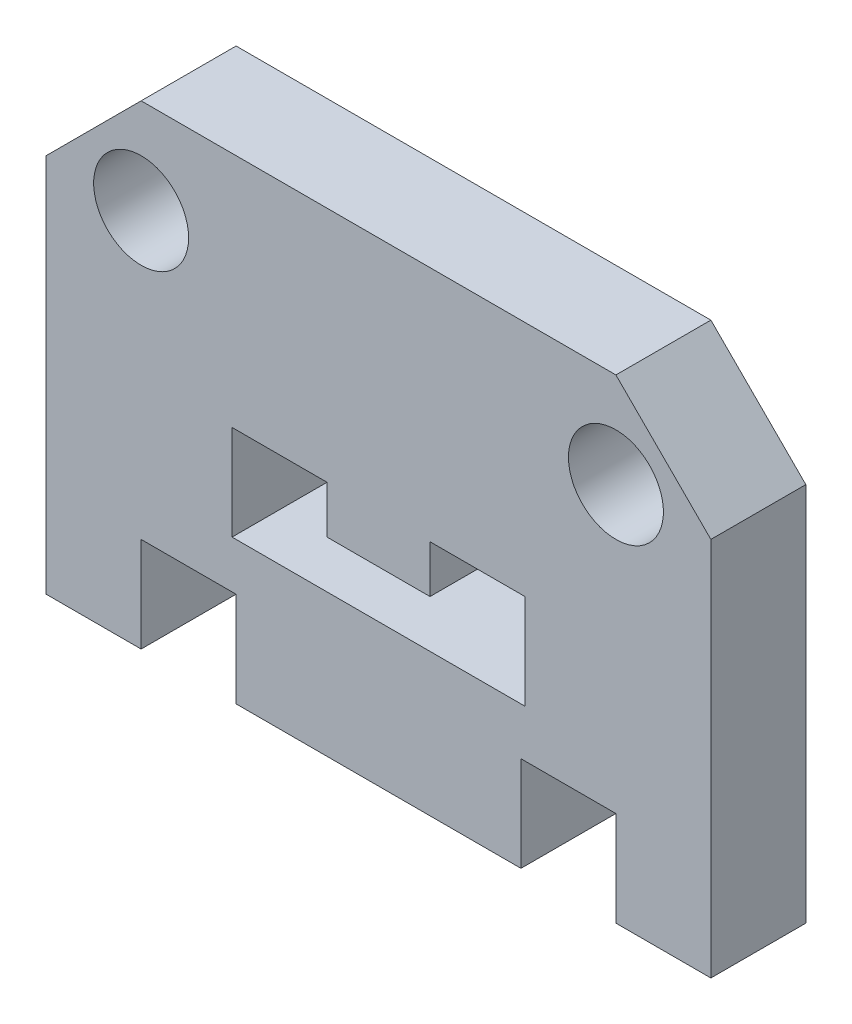
from build123d import *

# Parameters (mm, degrees)
SKETCH1_R           = 5
BOSS_EXTRUDE2_DEPTH = 10


with BuildPart() as part:
    # Sketch1 → Boss-Extrude2 (new body)
    with BuildSketch(Plane.XY):
        Polygon((25, 12.144578313), (-25, 12.144578313), (-35, 2.144578313), (-35, -37.855421687), (-25, -37.855421687), (-25, -27.855421687), (-15, -27.855421687), (-15, -37.855421687), (15, -37.855421687), (15, -27.855421687), (25, -27.855421687), (25, -37.855421687), (35, -37.855421687), (35, 2.144578313), align=None)
        with Locations((-25, 2.144578313)):
            Circle(SKETCH1_R, mode=Mode.SUBTRACT)
        with Locations(Location((25, 2.144578313, 0), (0, 0, 180))):
            Circle(SKETCH1_R, mode=Mode.SUBTRACT)
        Polygon((5.421686747, -17.855421687), (-5.421686747, -17.855421687), (-5.421686747, -12.855421687), (-15.421686747, -12.855421687), (-15.421686747, -22.855421687), (15.421686747, -22.855421687), (15.421686747, -12.855421687), (5.421686747, -12.855421687), align=None, mode=Mode.SUBTRACT)
    extrude(amount=BOSS_EXTRUDE2_DEPTH)


solid = part.part
